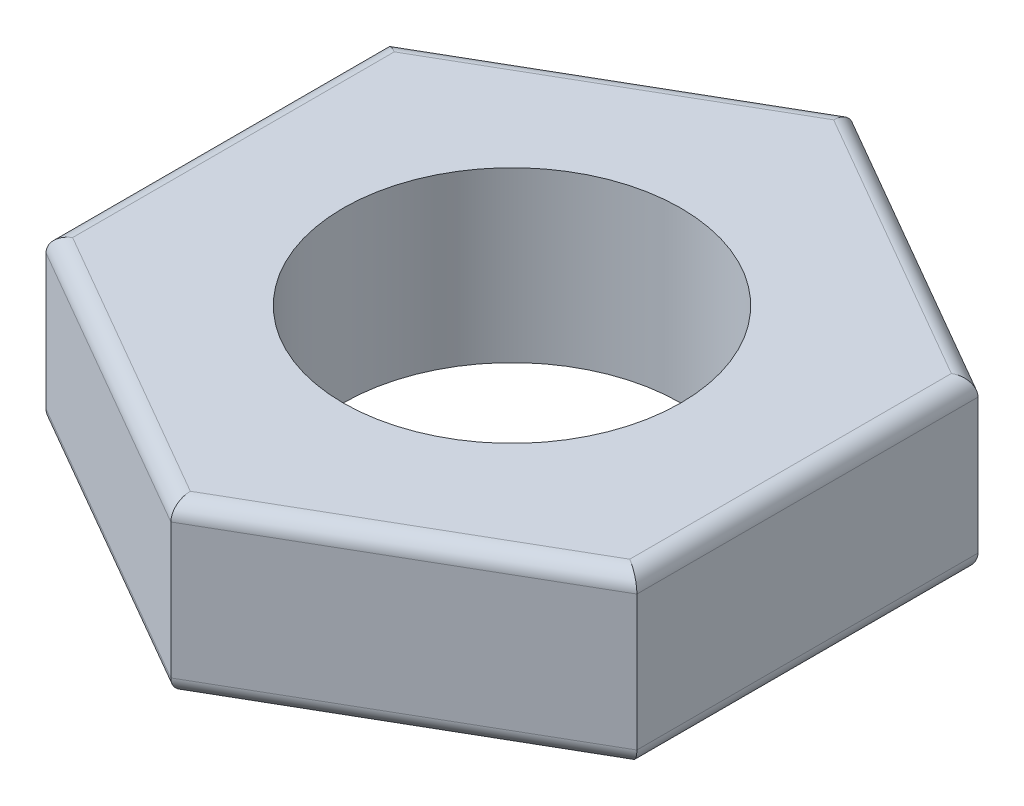
from build123d import *

# Parameters (mm, degrees)
BOSS_EXTRUDE1_DEPTH      = 2
F_4_0_4_DIAMETER_HOLE1_D = 4
FILLET1_R                = 0.2


with BuildPart() as part:
    # Sketch1 → Boss-Extrude1 (new body)
    with BuildSketch(Plane(origin=(0, 2, 0), x_dir=(1, 0, 0), z_dir=(0, 1, 0))):
        Polygon((0, 4.041451884), (-3.5, 2.020725942), (-3.5, -2.020725942), (0, -4.041451884), (3.5, -2.020725942), (3.5, 2.020725942), align=None)
    extrude(amount=-BOSS_EXTRUDE1_DEPTH)

    # Ø4.0 (4) Diameter Hole1 (through all)
    with Locations(Plane(origin=(0, 0, 0), x_dir=(-1, 0, 0), z_dir=(0, -1, 0))):
        with Locations((0, 0)):
            Hole(F_4_0_4_DIAMETER_HOLE1_D / 2)

    # Fillet1
    fillet1_edges = [part.edges().sort_by_distance(p)[0] for p in [
        (-3.5, 0, 0),
        (-1.75, 0, 3.031088913),
        (1.75, 0, 3.031088913),
        (3.5, 0, 0),
        (1.75, 0, -3.031088913),
        (3.5, 2, 0),
        (1.75, 2, 3.031088913),
        (-1.75, 2, 3.031088913),
        (-3.5, 2, 0),
        (-1.75, 2, -3.031088913),
        (1.75, 2, -3.031088913),
        (-1.75, 0, -3.031088913),
    ]]
    fillet(fillet1_edges, radius=FILLET1_R)


solid = part.part
